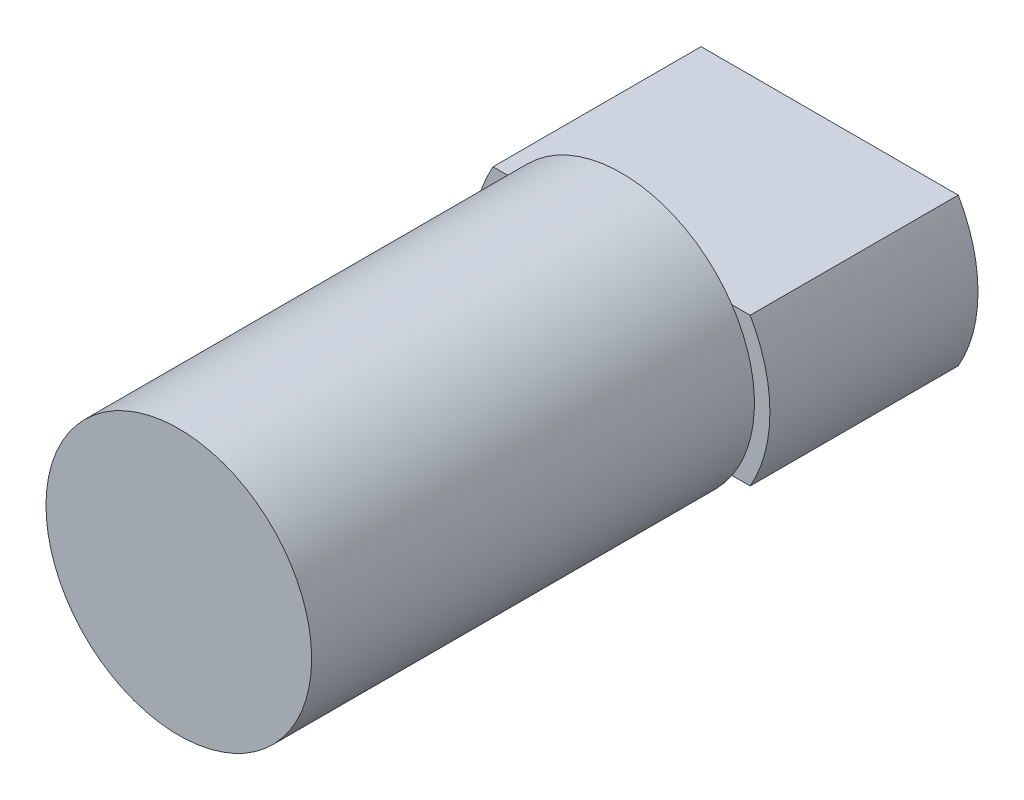
from build123d import *

# Parameters (mm, degrees)
SKETCH_1_W      = 29.04066115
SKETCH_1_H      = 16.7
EXTRUDE_3_DEPTH = 23.5
SKETCH_3_R      = 15
EXTRUDE_4_DEPTH = 50


with BuildPart() as part:
    # 草图1 → 凸台-拉伸3 (new body)
    with BuildSketch(Plane.XY):
        Rectangle(SKETCH_1_W, SKETCH_1_H)
        with BuildLine():
            Line((-14.520330575, -8.35), (-14.520330575, 8.35))
            ThreePointArc((-14.520330575, 8.35), (-16.75, 0), (-14.520330575, -8.35))
        make_face()
        with BuildLine():
            Line((14.520330575, -8.35), (14.520330575, 8.35))
            ThreePointArc((14.520330575, 8.35), (16.75, 0), (14.520330575, -8.35))
        make_face()
    extrude(amount=-EXTRUDE_3_DEPTH)

    # 草图3 → 凸台-拉伸4 (add)
    with BuildSketch(Plane.XY):
        with Locations(Location((0, 0, 0), (0, 0, 146.174412464))):
            Circle(SKETCH_3_R)
    extrude(amount=EXTRUDE_4_DEPTH)


solid = part.part
